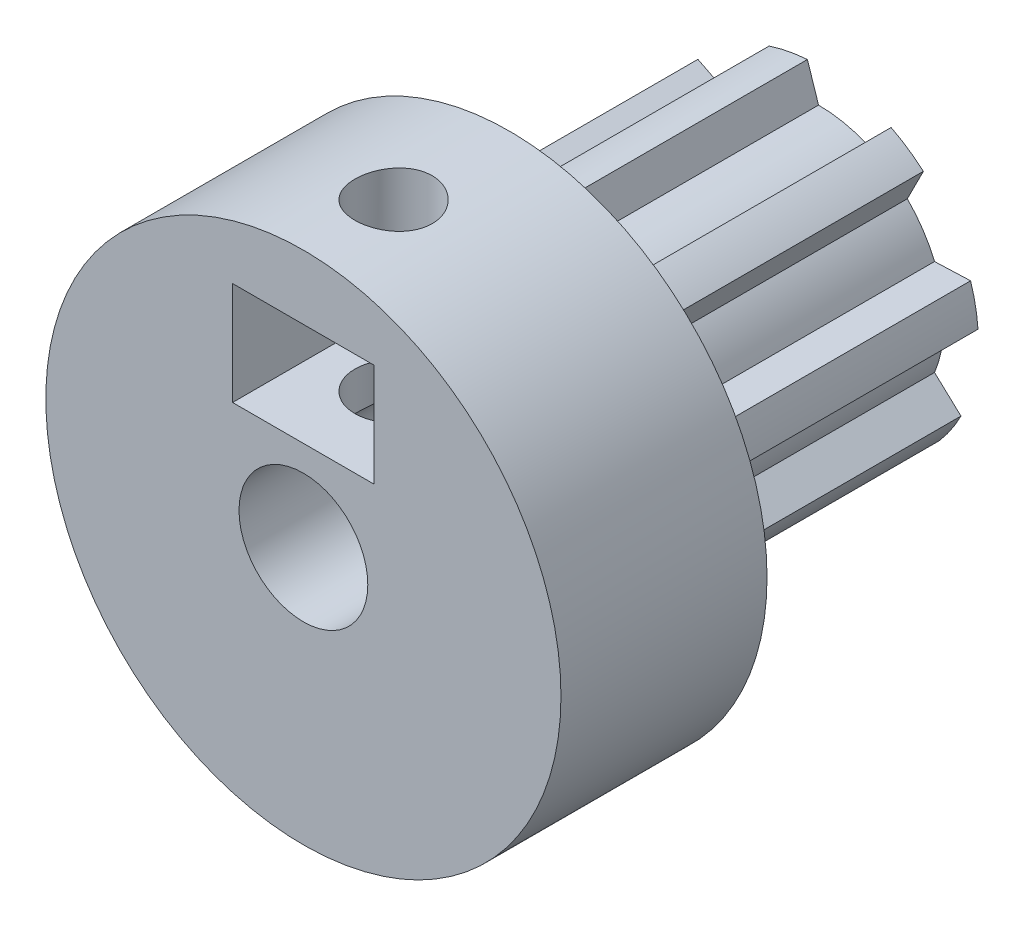
from build123d import *

# Parameters (mm, degrees)
BOSS_EXTRUDE1_DEPTH          = 12
SKETCH2_R                    = 10
BOSS_EXTRUDE2_DEPTH          = 8
F_5_0_5_DIAMETER_HOLE1_D     = 5
F_5_0_5_DIAMETER_HOLE1_DEPTH = 25
F_5_0_5_DIAMETER_HOLE1_TIP   = 1.502151548
SKETCH6_R                    = 1.5
CUT_EXTRUDE1_DEPTH           = 11
SKETCH8_R                    = 1.5
CUT_EXTRUDE2_DEPTH           = 4


with BuildPart() as part:
    # Sketch1 → Boss-Extrude1 (new body)
    with BuildSketch(Plane.XY.offset(26)):
        with BuildLine():
            Line((4.873707659, 0), (6.190281068, 0.43286662))
            ThreePointArc((6.190281068, 0.43286662), (6.091386481, 1.184045587), (5.901683351, 1.917573162))
            Line((5.901683351, 1.917573162), (4.502718754, 1.865087175))
            ThreePointArc((4.502718754, 1.865087175), (4.052339818, 2.7076869), (3.446231735, 3.446231735))
            Line((3.446231735, 3.446231735), (4.071106798, 4.683272643))
            ThreePointArc((4.071106798, 4.683272643), (3.470014023, 5.144507351), (2.817191332, 5.529049304))
            Line((2.817191332, 5.529049304), (1.865087175, 4.502718754))
            ThreePointArc((1.865087175, 4.502718754), (0.950813197, 4.780060733), (0, 4.873707659))
            Line((0, 4.873707659), (-0.43286662, 6.190281068))
            ThreePointArc((-0.43286662, 6.190281068), (-1.184045587, 6.091386481), (-1.917573162, 5.901683351))
            Line((-1.917573162, 5.901683351), (-1.865087175, 4.502718754))
            ThreePointArc((-1.865087175, 4.502718754), (-2.7076869, 4.052339818), (-3.446231735, 3.446231735))
            Line((-3.446231735, 3.446231735), (-4.683272643, 4.071106798))
            ThreePointArc((-4.683272643, 4.071106798), (-5.144507351, 3.470014023), (-5.529049304, 2.817191332))
            Line((-5.529049304, 2.817191332), (-4.502718754, 1.865087175))
            ThreePointArc((-4.502718754, 1.865087175), (-4.780060733, 0.950813197), (-4.873707659, 0))
            Line((-4.873707659, 0), (-6.190281068, -0.43286662))
            ThreePointArc((-6.190281068, -0.43286662), (-6.091386481, -1.184045587), (-5.901683351, -1.917573162))
            Line((-5.901683351, -1.917573162), (-4.502718754, -1.865087175))
            ThreePointArc((-4.502718754, -1.865087175), (-4.052339818, -2.7076869), (-3.446231735, -3.446231735))
            Line((-3.446231735, -3.446231735), (-4.071106798, -4.683272643))
            ThreePointArc((-4.071106798, -4.683272643), (-3.470014023, -5.144507351), (-2.817191332, -5.529049304))
            Line((-2.817191332, -5.529049304), (-1.865087175, -4.502718754))
            ThreePointArc((-1.865087175, -4.502718754), (-0.950813197, -4.780060733), (0, -4.873707659))
            Line((0, -4.873707659), (0.43286662, -6.190281068))
            ThreePointArc((0.43286662, -6.190281068), (1.184045587, -6.091386481), (1.917573162, -5.901683351))
            Line((1.917573162, -5.901683351), (1.865087175, -4.502718754))
            ThreePointArc((1.865087175, -4.502718754), (2.7076869, -4.052339818), (3.446231735, -3.446231735))
            Line((3.446231735, -3.446231735), (4.683272643, -4.071106798))
            ThreePointArc((4.683272643, -4.071106798), (5.144507351, -3.470014023), (5.529049304, -2.817191332))
            Line((5.529049304, -2.817191332), (4.502718754, -1.865087175))
            ThreePointArc((4.502718754, -1.865087175), (4.780060733, -0.950813197), (4.873707659, 0))
        make_face()
    extrude(amount=-BOSS_EXTRUDE1_DEPTH)

    # Sketch2 → Boss-Extrude2 (add)
    with BuildSketch(Plane.XY.offset(26)):
        Circle(SKETCH2_R)
    extrude(amount=BOSS_EXTRUDE2_DEPTH)

    # Ø5.0 (5) Diameter Hole1
    with Locations(Plane(origin=(0, 0, 14), x_dir=(-1, 0, 0), z_dir=(0, 0, -1))):
        with Locations((0, 0)):
            Hole(F_5_0_5_DIAMETER_HOLE1_D / 2, depth=F_5_0_5_DIAMETER_HOLE1_DEPTH)
            with Locations((0, 0, -(F_5_0_5_DIAMETER_HOLE1_DEPTH + F_5_0_5_DIAMETER_HOLE1_TIP / 2))):  # 118° drill point
                Cone(0, F_5_0_5_DIAMETER_HOLE1_D / 2, F_5_0_5_DIAMETER_HOLE1_TIP, mode=Mode.SUBTRACT)

    # Sketch6 → Cut-Extrude1 (cut)
    with BuildSketch(Plane(origin=(0, 0, 0), x_dir=(1, 0, 0), z_dir=(0, 1, 0))):
        with Locations(Location((0, -30.5, 0), (0, 0, 90))):
            Circle(SKETCH6_R)
    extrude(amount=CUT_EXTRUDE1_DEPTH, mode=Mode.SUBTRACT)

    # Sketch8 → Cut-Extrude2 (cut)
    with BuildSketch(Plane(origin=(0, 3.5, 0), x_dir=(-1, 0, 0), z_dir=(0, 1, 0))):
        Polygon((-2.75, 32.08771324), (-2.75, 34), (2.75, 34), (2.75, 32.08771324), (2.75, 28.91228676), (0, 27.324573519), (-2.75, 28.91228676), align=None)
        with Locations(Location((0, 30.5, 0), (0, 0, 270))):
            Circle(SKETCH8_R, mode=Mode.SUBTRACT)
    extrude(amount=CUT_EXTRUDE2_DEPTH, mode=Mode.SUBTRACT)


solid = part.part
